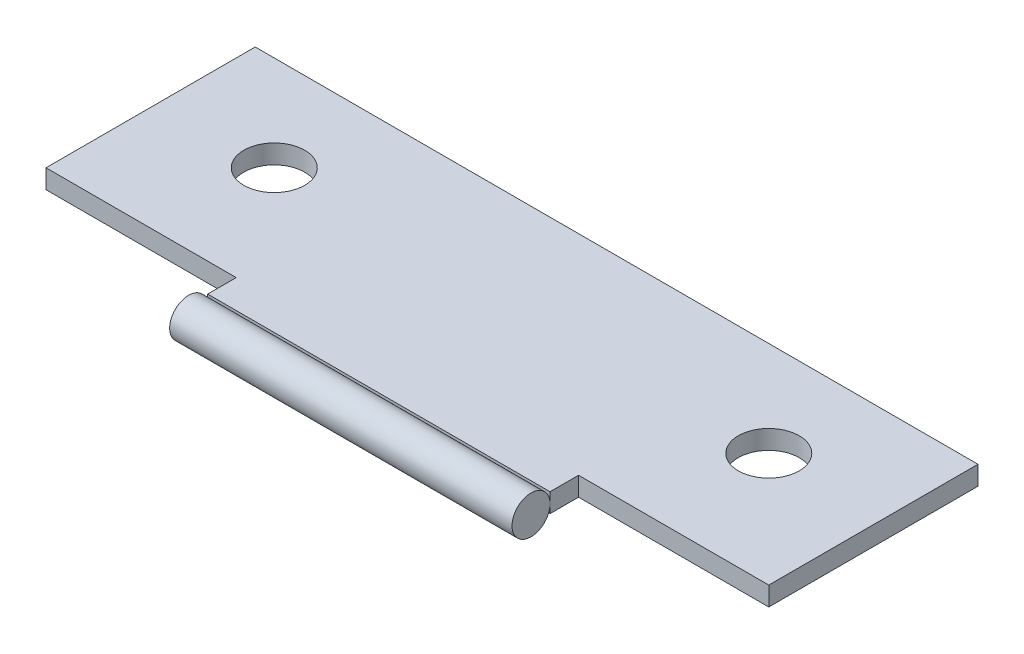
from build123d import *

# Parameters (mm, degrees)
EXTRUDE_1_DEPTH     = 1
SKETCH_2_R          = 1
EXTRUDE_2_DEPTH     = 18
SKETCH_3_R          = 1.6
CUT_EXTRUDE_1_DEPTH = 1


with BuildPart() as part:
    # 草图1 → 凸台-拉伸1 (new body)
    with BuildSketch(Plane(origin=(0, 0, 0), x_dir=(1, 0, 0), z_dir=(0, 1, 0))):
        Polygon((-19, 5.5), (19, 5.5), (19, -5.5), (9, -5.5), (9, -7), (-9, -7), (-9, -5.5), (-19, -5.5), align=None)
    extrude(amount=EXTRUDE_1_DEPTH)

    # 草图3 → 切除-拉伸1 (cut)
    with BuildSketch(Plane(origin=(0, 1, 0), x_dir=(1, 0, 0), z_dir=(0, 1, 0))):
        with Locations(Location((-13, 0.5, 0), (0, 0, 270))):
            Circle(SKETCH_3_R)
        with Locations(Location((13, 0.5, 0), (0, 0, 270))):
            Circle(SKETCH_3_R)
    extrude(amount=-CUT_EXTRUDE_1_DEPTH, mode=Mode.SUBTRACT)


with BuildPart() as body_2:
    # 草图2 → 凸台-拉伸2 (new body)
    with BuildSketch(Plane(origin=(9, 0, 0), x_dir=(0, 0, -1), z_dir=(1, 0, 0))):
        with Locations((-8, 0.445452926)):
            Circle(SKETCH_2_R)
    extrude(amount=-EXTRUDE_2_DEPTH)


solid = Compound([part.part, body_2.part])
